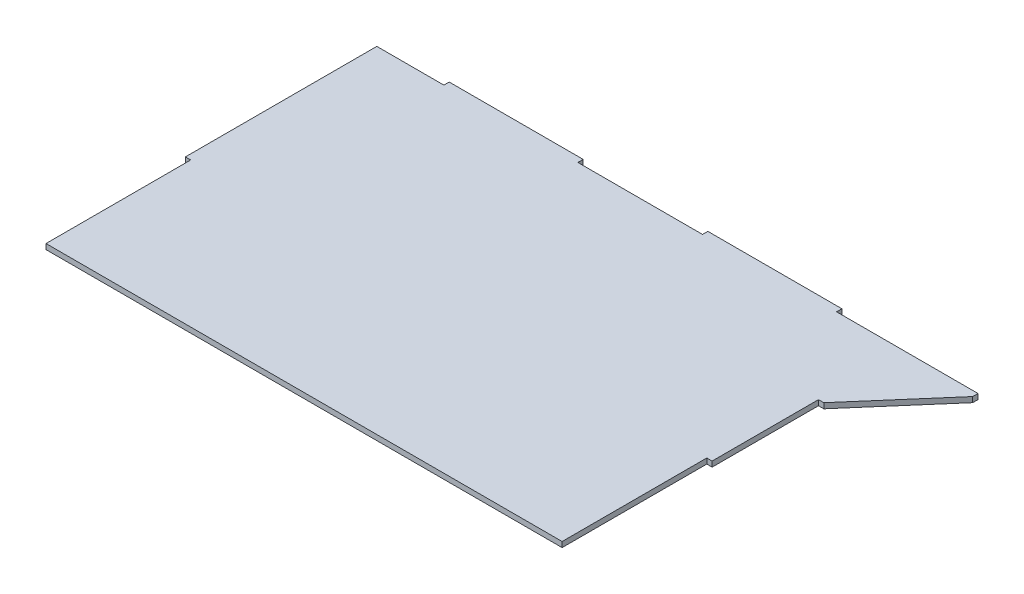
from build123d import *

# Parameters (mm, degrees)
SKETCH1_W           = 314.4612
SKETCH1_H           = 3.175
BOSS_EXTRUDE1_DEPTH = 200.66180012
CUT_EXTRUDE2_START  = -3.175
SKETCH5_W           = 3.175
SKETCH5_H           = 86.36
CUT_EXTRUDE2_DEPTH  = 259.119504214
SKETCH3_W           = 80
SKETCH3_H           = 3.175
BOSS_EXTRUDE2_DEPTH = 3.175
LPATTERN2_COUNT     = 2
LPATTERN2_PITCH     = 154.43
BOSS_EXTRUDE3_DEPTH = 3.175


with BuildPart() as part:
    # Sketch1 → Boss-Extrude1 (new body)
    with BuildSketch(Plane.XY):
        Rectangle(SKETCH1_W, SKETCH1_H)
    extrude(amount=BOSS_EXTRUDE1_DEPTH)

    # Sketch5 → Cut-Extrude2 (cut)
    with BuildSketch(Plane(origin=(0, 1.5875, 0), x_dir=(1, 0, 0), z_dir=(0, 1, 0)).offset(CUT_EXTRUDE2_START)):
        with Locations((-155.6431, -157.48180012)):
            Rectangle(SKETCH5_W, SKETCH5_H)
    cut_extrude2 = extrude(amount=CUT_EXTRUDE2_DEPTH, mode=Mode.SUBTRACT)

    # Mirror1: Cut-Extrude2 across plane
    add(cut_extrude2.mirror(Plane(origin=(0, 0, 0), x_dir=(0, 0, 1), z_dir=(1, 0, 0))), mode=Mode.SUBTRACT)

    # Sketch3 → Boss-Extrude2 (add)
    with BuildSketch(Plane(origin=(0, 0, 0), x_dir=(-1, 0, 0), z_dir=(0, 0, -1))):
        with Locations((-77.2306, 0)):
            Rectangle(SKETCH3_W, SKETCH3_H)
    boss_extrude2 = extrude(amount=BOSS_EXTRUDE2_DEPTH)

    # LPattern2: Boss-Extrude2 ×2
    with Locations(*[(-i * LPATTERN2_PITCH, 0, 0) for i in range(1, LPATTERN2_COUNT)]):
        add(boss_extrude2)

    # Sketch10 → Boss-Extrude3 (add)
    with BuildSketch(Plane.XZ.offset(1.5875)):
        Polygon((201.66536, 0), (201.66536, 3.175), (160.4056, 50.8), (157.2306, 50.8), (157.2306, 0), align=None)
    extrude(amount=-BOSS_EXTRUDE3_DEPTH)


solid = part.part
